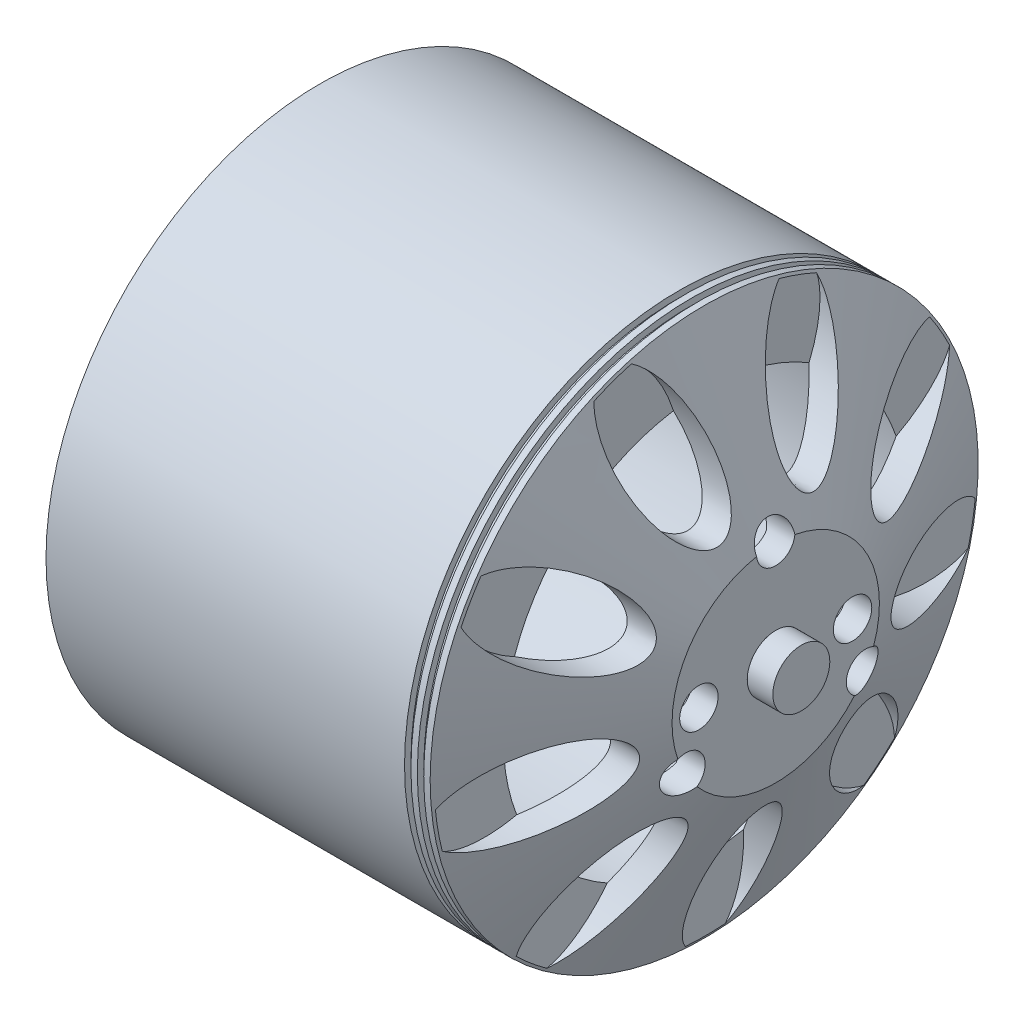
from build123d import *

# Parameters (mm, degrees)
SKETCH2_R           = 1.5
CUT_EXTRUDE2_DEPTH  = 10
SKETCH3_RX          = 6
SKETCH3_RY          = 3
CUT_EXTRUDE6_DEPTH  = 5.5
CIRPATTERN1_COUNT   = 9
SKETCH4_R           = 2.224748527
SKETCH4_R_2         = 2
BOSS_EXTRUDE1_DEPTH = 2
SKETCH5_R           = 2
BOSS_EXTRUDE4_DEPTH = 7


with BuildPart() as part:
    # Sketch1 → Revolve2 (revolve)
    with BuildSketch(Plane(origin=(0, 0, 0), x_dir=(1, 0, 0), z_dir=(0, 1, 0)), mode=Mode.PRIVATE) as revolve2_sk:
        Polygon((36.774825542, 3.48079471), (36.774825542, 2.224748527), (39.727968837, 2.224748527), (41.752859891, 2.224748527), (41.752859891, 8.097389691), (36.163734806, 21.4), (35.663734806, 21.4), (35.663734806, 20.9), (35.163734806, 20.9), (35.163734806, 21.4), (34.663734806, 21.4), (34.663734806, 20.9), (34.163734806, 20.9), (34.163734806, 21.4), (6.163734806, 21.4), (6.163734806, 19.400440685), (33.743910997, 19.400440685), (34.727968837, 19.400440685), (39.727968837, 7.5), (39.727968837, 3.48079471), align=None)
    revolve(revolve2_sk.sketch.rotate(Axis((0, 0, 0), (1, 0, 0)), 180), axis=Axis((0, 0, 0), (1, 0, 0)))

    # Sketch2 → Cut-Extrude2 (cut)
    with BuildSketch(Plane(origin=(41.752859891, 0, 0), x_dir=(0, 0, -1), z_dir=(1, 0, 0))):
        with Locations(Location((-7.012545177, -4.048694845, 0), (0, 0, 328.436946014))):
            Circle(SKETCH2_R)
        with Locations(Location((7.012545177, -4.048694845, 0), (0, 0, 65.314492282))):
            Circle(SKETCH2_R)
        with Locations(Location((0, 8.097389691, 0), (0, 0, 354.685507045))):
            Circle(SKETCH2_R)
        with Locations((6, 0)):
            Circle(SKETCH2_R)
        with Locations((-6, 0)):
            Circle(SKETCH2_R)
    extrude(amount=-CUT_EXTRUDE2_DEPTH, mode=Mode.SUBTRACT)

    # Sketch3 → Cut-Extrude6 (cut)
    with BuildSketch(Plane(origin=(41.752859891, 0, 0), x_dir=(0, 0, -1), z_dir=(1, 0, 0))):
        with Locations(Location((0, -16), (0, 0, 90))):
            Ellipse(SKETCH3_RX, SKETCH3_RY)
    cut_extrude6 = extrude(amount=-CUT_EXTRUDE6_DEPTH, mode=Mode.SUBTRACT)

    # CirPattern1: Cut-Extrude6 ×9 about axis
    cirpattern1_axis = Axis((41.752859891, 0, 0), (-1, 0, 0))
    for i in range(1, CIRPATTERN1_COUNT):
        add(cut_extrude6.rotate(cirpattern1_axis, i * 360 / CIRPATTERN1_COUNT), mode=Mode.SUBTRACT)


with BuildPart() as body_2:
    # Sketch4 → Boss-Extrude1 (new body)
    with BuildSketch(Plane(origin=(41.752859891, 0, 0), x_dir=(0, 0, -1), z_dir=(1, 0, 0))):
        Circle(SKETCH4_R)
        Circle(SKETCH4_R_2, mode=Mode.SUBTRACT)
    extrude(amount=BOSS_EXTRUDE1_DEPTH)

    # Sketch5 → Boss-Extrude4 (add)
    with BuildSketch(Plane(origin=(43.752859891, 0, 0), x_dir=(0, 0, -1), z_dir=(1, 0, 0))):
        Circle(SKETCH5_R)
    extrude(amount=-BOSS_EXTRUDE4_DEPTH)


solid = Compound([part.part, body_2.part])
